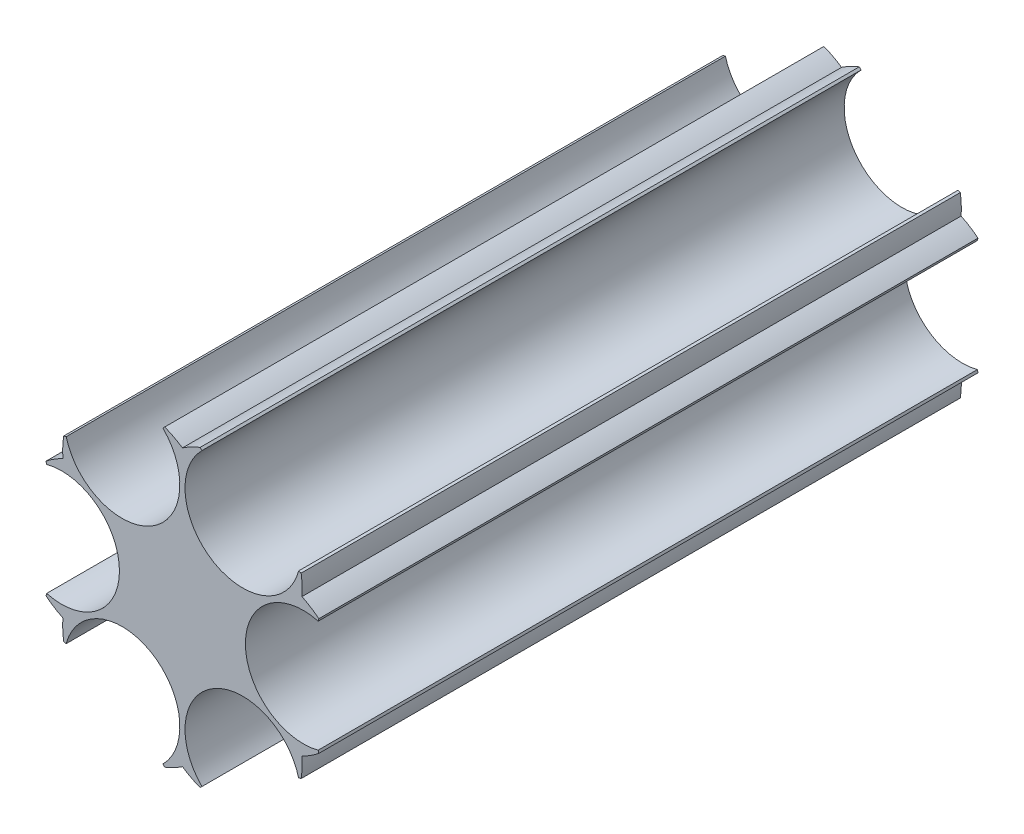
from build123d import *

# Parameters (mm, degrees)
BOSS_EXTRU_1_DEPTH = 191


with BuildPart() as part:
    # Esquisse1 → Boss.-Extru.1 (new body)
    with BuildSketch(Plane.XY):
        with BuildLine():
            Line((-39.529333289, 16.90370196), (-39.335219005, 16.17925759))
            ThreePointArc((-39.335219005, 16.17925759), (-18.25, 0), (-39.335219005, -16.17925759))
            Line((-39.335219005, -16.17925759), (-39.529333289, -16.90370196))
            ThreePointArc((-39.529333289, -16.90370196), (-37.17213026, -18.592337614), (-34.635254916, -19.996673749))
            ThreePointArc((-34.635254916, -19.996673749), (-34.68750182, -22.895840311), (-34.40370196, -25.781555843))
            Line((-34.40370196, -25.781555843), (-33.67925759, -25.975670127))
            ThreePointArc((-33.67925759, -25.975670127), (-9.125, -15.804963619), (-5.655961415, -42.154927717))
            Line((-5.655961415, -42.154927717), (-5.125631329, -42.685257803))
            ThreePointArc((-5.125631329, -42.685257803), (-2.48462844, -41.488177925), (0, -39.993347498))
            ThreePointArc((0, -39.993347498), (2.48462844, -41.488177925), (5.125631329, -42.685257803))
            Line((5.125631329, -42.685257803), (5.655961415, -42.154927717))
            ThreePointArc((5.655961415, -42.154927717), (9.125, -15.804963619), (33.67925759, -25.975670127))
            Line((33.67925759, -25.975670127), (34.40370196, -25.781555843))
            ThreePointArc((34.40370196, -25.781555843), (34.68750182, -22.895840311), (34.635254916, -19.996673749))
            ThreePointArc((34.635254916, -19.996673749), (37.17213026, -18.592337614), (39.529333289, -16.90370196))
            Line((39.529333289, -16.90370196), (39.335219005, -16.17925759))
            ThreePointArc((39.335219005, -16.17925759), (18.25, 0), (39.335219005, 16.17925759))
            Line((39.335219005, 16.17925759), (39.529333289, 16.90370196))
            ThreePointArc((39.529333289, 16.90370196), (37.17213026, 18.592337614), (34.635254916, 19.996673749))
            ThreePointArc((34.635254916, 19.996673749), (34.68750182, 22.895840311), (34.40370196, 25.781555843))
            Line((34.40370196, 25.781555843), (33.67925759, 25.975670127))
            ThreePointArc((33.67925759, 25.975670127), (9.125, 15.804963619), (5.655961415, 42.154927717))
            Line((5.655961415, 42.154927717), (5.125631329, 42.685257803))
            ThreePointArc((5.125631329, 42.685257803), (2.48462844, 41.488177925), (0, 39.993347498))
            ThreePointArc((0, 39.993347498), (-2.48462844, 41.488177925), (-5.125631329, 42.685257803))
            Line((-5.125631329, 42.685257803), (-5.655961415, 42.154927717))
            ThreePointArc((-5.655961415, 42.154927717), (-9.125, 15.804963619), (-33.67925759, 25.975670127))
            Line((-33.67925759, 25.975670127), (-34.40370196, 25.781555843))
            ThreePointArc((-34.40370196, 25.781555843), (-34.68750182, 22.895840311), (-34.635254916, 19.996673749))
            ThreePointArc((-34.635254916, 19.996673749), (-37.17213026, 18.592337614), (-39.529333289, 16.90370196))
        make_face()
    extrude(amount=BOSS_EXTRU_1_DEPTH)


solid = part.part
